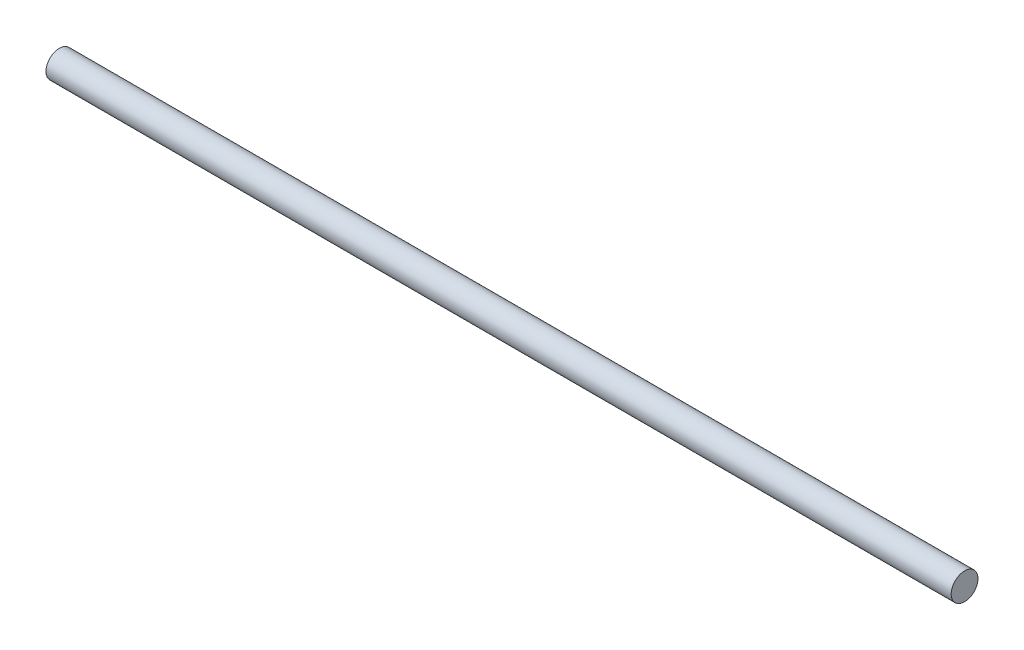
from build123d import *

# Parameters (mm, degrees)
SKETCH1_R           = 4
BOSS_EXTRUDE1_DEPTH = 270
SKETCH2_R           = 2.626
CUT_EXTRUDE1_DEPTH  = 40


with BuildPart() as part:
    # Sketch1 → Boss-Extrude1 (new body)
    with BuildSketch(Plane(origin=(0, 0, 0), x_dir=(0, 0, -1), z_dir=(1, 0, 0))):
        Circle(SKETCH1_R)
    extrude(amount=BOSS_EXTRUDE1_DEPTH)

    # Sketch2 → Cut-Extrude1 (cut)
    with BuildSketch(Plane.ZY):
        Circle(SKETCH2_R)
    extrude(amount=-CUT_EXTRUDE1_DEPTH, mode=Mode.SUBTRACT)


solid = part.part
